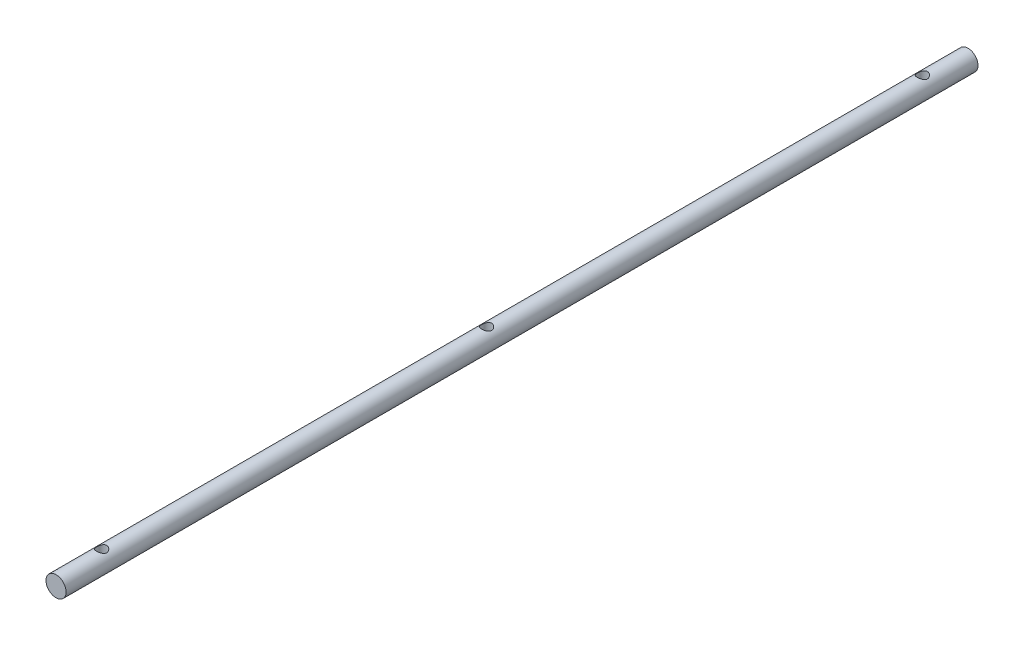
from build123d import *

# Parameters (mm, degrees)
SKETCH2_R               = 1.985
BOSS_EXTRUDE1_DEPTH     = 180
CUT_EXTRUDE1_DEPTH      = 181.021888808
CUT_EXTRUDE1_DEPTH_BACK = 181.021888808
SKETCH4_R               = 1


with BuildPart() as part:
    # Sketch2 → Boss-Extrude1 (new body)
    with BuildSketch(Plane.XY):
        with Locations(Location((0, 0, 0), (0, 0, 180))):
            Circle(SKETCH2_R)
    extrude(amount=BOSS_EXTRUDE1_DEPTH)

    # Sketch4 → Cut-Extrude1 (cut, two sides: drawn at the far end of the back side and taken through both)
    with BuildSketch(Plane(origin=(0, 0, 0), x_dir=(1, 0, 0), z_dir=(0, 1, 0)).offset(-CUT_EXTRUDE1_DEPTH_BACK)):
        with Locations(Location((0, -171, 0), (0, 0, 270))):
            Circle(SKETCH4_R)
        with Locations(Location((0, -9, 0), (0, 0, 270))):
            Circle(SKETCH4_R)
        with Locations(Location((0, -95.02, 0), (0, 0, 270))):
            Circle(SKETCH4_R)
    extrude(amount=CUT_EXTRUDE1_DEPTH + CUT_EXTRUDE1_DEPTH_BACK, mode=Mode.SUBTRACT)


solid = part.part
